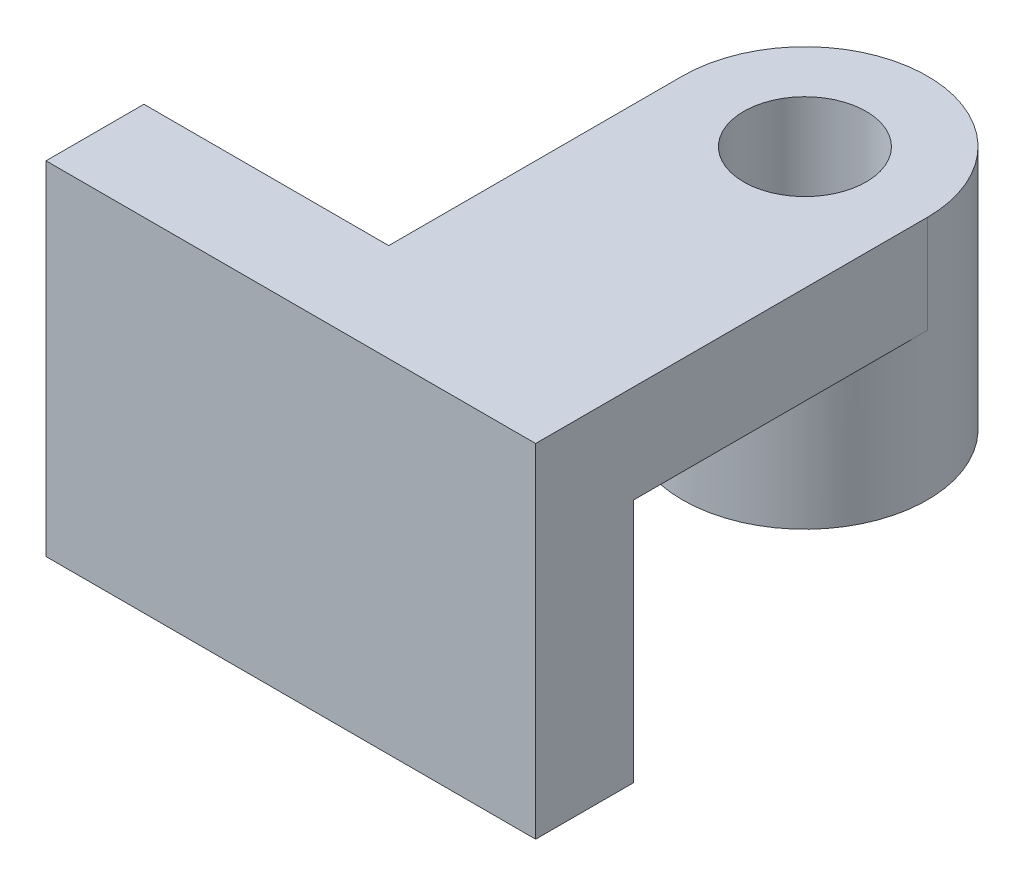
from build123d import *

# Parameters (mm, degrees)
ESQUISSE_BASE_W         = 127
ESQUISSE_BASE_H         = 88.9
VOLUME_BASE_DEPTH       = 25.4
ESQUISSE_ARRIERE_W      = 63.5
ESQUISSE_ARRIERE_H      = 101.6
VOLUME_ARRIERE_DEPTH    = 25.4
ESQUISSE_CYLINDRE_R     = 31.75
VOLUME_CYLINDRE_DEPTH   = 63.5
ESQUISSE4_R             = 15.875
ENL_V_MAT_EXTRU_1_DEPTH = 154.586010105


with BuildPart() as part:
    # ESQUISSE_BASE → VOLUME_BASE (new body)
    with BuildSketch(Plane.XY):
        Rectangle(ESQUISSE_BASE_W, ESQUISSE_BASE_H)
    extrude(amount=VOLUME_BASE_DEPTH)

    # ESQUISSE_ARRIERE → VOLUME_ARRIERE (add)
    with BuildSketch(Plane(origin=(0, 44.45, 0), x_dir=(1, 0, 0), z_dir=(0, 1, 0))):
        with Locations((31.75, 25.4)):
            Rectangle(ESQUISSE_ARRIERE_W, ESQUISSE_ARRIERE_H)
    extrude(amount=-VOLUME_ARRIERE_DEPTH)

    # ESQUISSE_CYLINDRE → VOLUME_CYLINDRE (add)
    with BuildSketch(Plane(origin=(0, 44.45, 0), x_dir=(1, 0, 0), z_dir=(0, 1, 0))):
        with Locations(Location((31.75, 76.2, 0), (0, 0, 270))):
            Circle(ESQUISSE_CYLINDRE_R)
    extrude(amount=-VOLUME_CYLINDRE_DEPTH)

    # Esquisse4 → Enlèv. mat.-Extru.1 (cut, through all)
    with BuildSketch(Plane(origin=(0, 44.45, 0), x_dir=(1, 0, 0), z_dir=(0, 1, 0))):
        with Locations(Location((31.75, 76.2, 0), (0, 0, 270))):
            Circle(ESQUISSE4_R)
    extrude(amount=-ENL_V_MAT_EXTRU_1_DEPTH, mode=Mode.SUBTRACT)


solid = part.part
